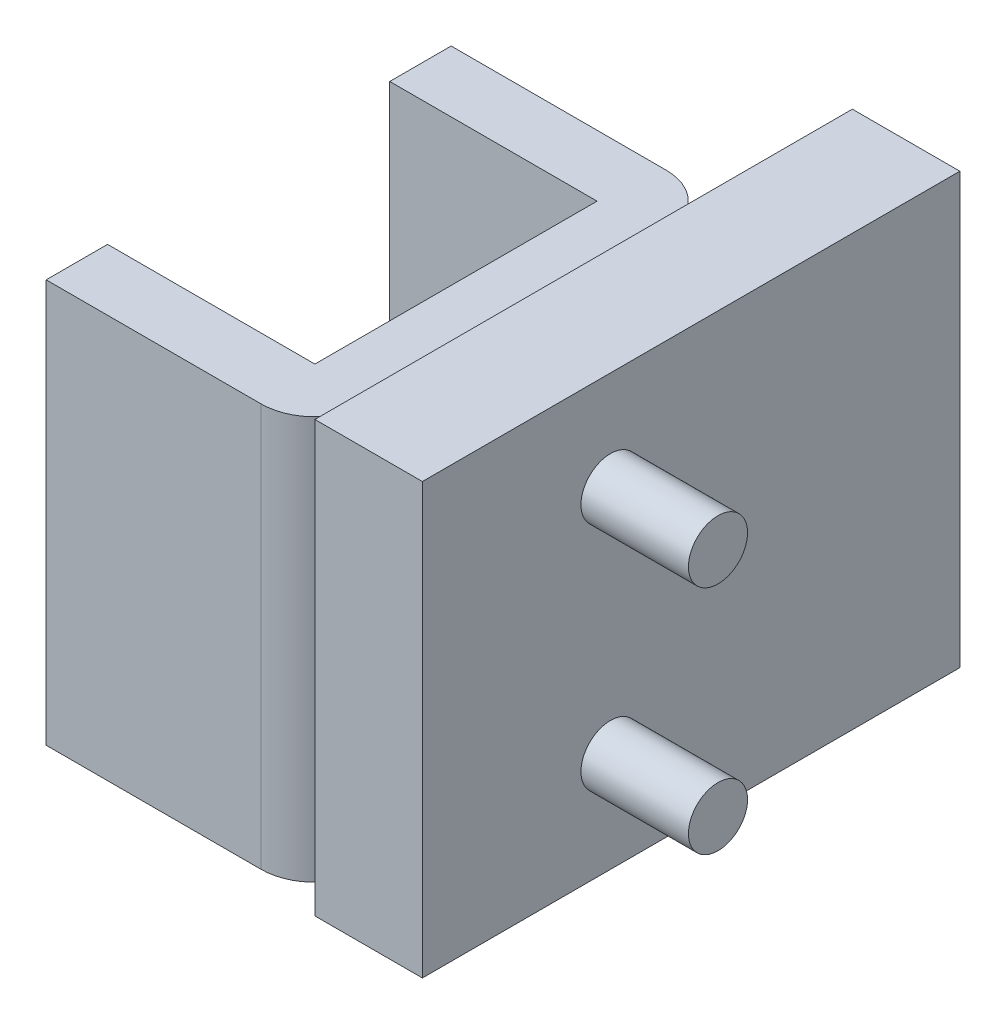
from build123d import *

# Parameters (mm, degrees)
EXTRUDE_4_DEPTH     = 15
SKETCH_6_W          = 5.43
SKETCH_6_H          = 10.5
CUT_EXTRUDE_2_DEPTH = 15
SKETCH_7_W          = 2.285
SKETCH_7_H          = 10.5
CUT_EXTRUDE_3_DEPTH = 15
SKETCH_8_W          = 20
SKETCH_8_H          = 16
EXTRUDE_5_DEPTH     = 4
SKETCH_9_R          = 1.1
EXTRUDE_6_DEPTH     = 4


with BuildPart() as part:
    # 草图1 → 凸台-拉伸4 (new body)
    with BuildSketch(Plane(origin=(0, 0, 0), x_dir=(1, 0, 0), z_dir=(0, 1, 0))):
        with BuildLine():
            Line((-35.94125392, 35.792894198), (-35.94125392, 20.722894198))
            Line((-35.94125392, 20.722894198), (-27.94125392, 20.722894198))
            ThreePointArc((-27.94125392, 20.722894198), (-26.527040358, 21.308680636), (-25.94125392, 22.722894198))
            Line((-25.94125392, 22.722894198), (-25.94125392, 33.792894198))
            ThreePointArc((-25.94125392, 33.792894198), (-26.527040358, 35.207107761), (-27.94125392, 35.792894198))
            Line((-27.94125392, 35.792894198), (-35.94125392, 35.792894198))
        make_face()
    extrude(amount=EXTRUDE_4_DEPTH)

    # 草图6 → 切除-拉伸2 (cut)
    with BuildSketch(Plane(origin=(0, 15, 0), x_dir=(1, 0, 0), z_dir=(0, 1, 0))):
        with Locations((-30.94125392, 28.257894198)):
            Rectangle(SKETCH_6_W, SKETCH_6_H)
    extrude(amount=-CUT_EXTRUDE_2_DEPTH, mode=Mode.SUBTRACT)

    # 草图7 → 切除-拉伸3 (cut)
    with BuildSketch(Plane(origin=(0, 15, 0), x_dir=(1, 0, 0), z_dir=(0, 1, 0))):
        with Locations((-34.79875392, 28.257894198)):
            Rectangle(SKETCH_7_W, SKETCH_7_H)
    extrude(amount=-CUT_EXTRUDE_3_DEPTH, mode=Mode.SUBTRACT)

    # 草图8 → 凸台-拉伸5 (add)
    with BuildSketch(Plane(origin=(-25.94125392, 0, 0), x_dir=(0, 0, -1), z_dir=(1, 0, 0))):
        with Locations((30.722894198, 7.5)):
            Rectangle(SKETCH_8_W, SKETCH_8_H)
    extrude(amount=EXTRUDE_5_DEPTH)

    # 草图9 → 凸台-拉伸6 (add)
    with BuildSketch(Plane(origin=(-21.94125392, 0, 0), x_dir=(0, 0, -1), z_dir=(1, 0, 0))):
        with Locations((27.722894198, 11.8)):
            Circle(SKETCH_9_R)
        with Locations((27.722894198, 3.2)):
            Circle(SKETCH_9_R)
    extrude(amount=EXTRUDE_6_DEPTH)


solid = part.part
